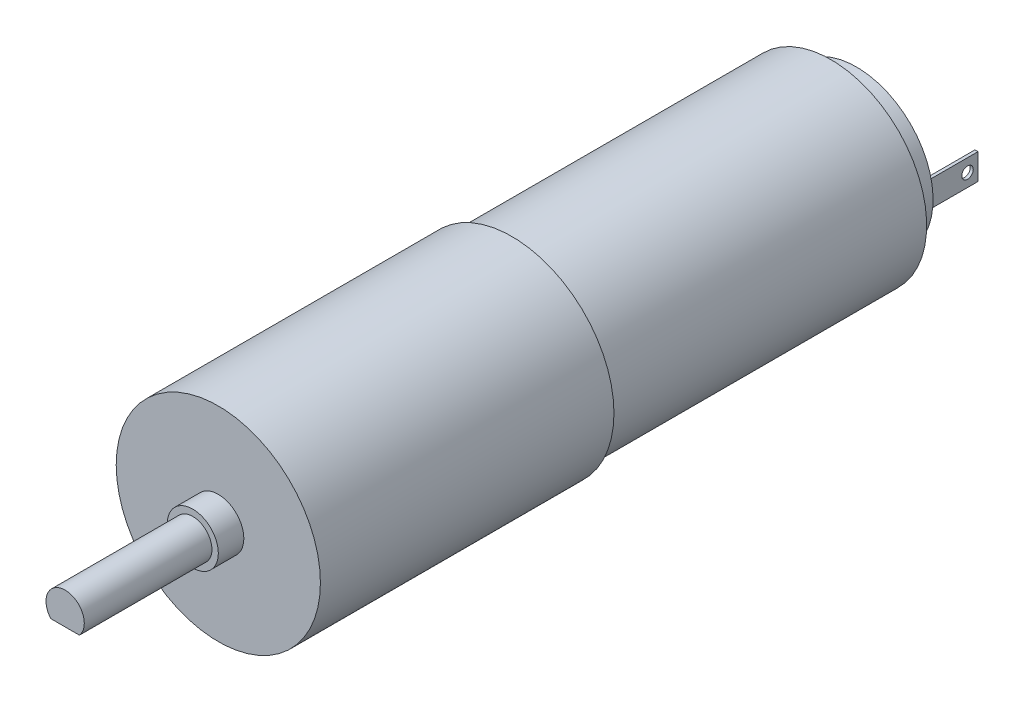
from build123d import *

# Parameters (mm, degrees)
SKETCH_1_R          = 8
EXTRUDE_1_DEPTH     = 23
SKETCH_2_R          = 6
EXTRUDE_2_DEPTH     = 27
SKETCH_3_R          = 1.5
EXTRUDE_3_DEPTH     = 12
SKETCH_4_R          = 2
EXTRUDE_4_DEPTH     = 2
SKETCH_5_R          = 7.5
EXTRUDE_6_DEPTH     = 25
CUT_EXTRUDE_2_DEPTH = 25
SKETCH_7_W          = 0.238746812
SKETCH_7_H          = 2.029347906
SKETCH_7_W_2        = 0.208903461
EXTRUDE_7_DEPTH     = 4
SKETCH_8_R          = 0.451828616
CUT_EXTRUDE_3_DEPTH = 40
SKETCH_9_W          = 4.595876138
SKETCH_9_H          = 0.537180328
CUT_EXTRUDE_4_DEPTH = 6


with BuildPart() as part:
    # 草图1 → 凸台-拉伸1 (new body)
    with BuildSketch(Plane.XY):
        Circle(SKETCH_1_R)
    extrude(amount=EXTRUDE_1_DEPTH)

    # 草图2 → 凸台-拉伸2 (add)
    with BuildSketch(Plane(origin=(0, 0, 0), x_dir=(-1, 0, 0), z_dir=(0, 0, -1))):
        Circle(SKETCH_2_R)
    extrude(amount=EXTRUDE_2_DEPTH)

    # 草图3 → 凸台-拉伸3 (add)
    with BuildSketch(Plane.XY.offset(23)):
        Circle(SKETCH_3_R)
    extrude(amount=EXTRUDE_3_DEPTH)

    # 草图4 → 凸台-拉伸4 (add)
    with BuildSketch(Plane.XY.offset(23)):
        Circle(SKETCH_4_R)
    extrude(amount=EXTRUDE_4_DEPTH)

    # 草图5 → 凸台-拉伸6 (add)
    with BuildSketch(Plane(origin=(0, 0, 0), x_dir=(-1, 0, 0), z_dir=(0, 0, -1))):
        with Locations(Location((0, 0, 0), (0, 0, 180))):
            Circle(SKETCH_5_R)
    extrude(amount=EXTRUDE_6_DEPTH)

    # 草图6 → 切除-拉伸2 (cut)
    with BuildSketch(Plane(origin=(0, 0, -25), x_dir=(-1, 0, 0), z_dir=(0, 0, -1))):
        Polygon((0, -6), (7.251934426, -6), (7.251934426, -9), (-7.072874317, -9), (-7.072874317, -6), align=None)
    extrude(amount=-CUT_EXTRUDE_2_DEPTH, mode=Mode.SUBTRACT)

    # 草图7 → 凸台-拉伸7 (add)
    with BuildSketch(Plane(origin=(0, 0, -27), x_dir=(-1, 0, 0), z_dir=(0, 0, -1))):
        with Locations((-5.40164663, 0)):
            Rectangle(SKETCH_7_W, SKETCH_7_H)
        with Locations((5.371803278, 0)):
            Rectangle(SKETCH_7_W_2, SKETCH_7_H)
    extrude(amount=EXTRUDE_7_DEPTH)

    # 草图8 → 切除-拉伸3 (cut)
    with BuildSketch(Plane(origin=(5.521020036, 0, 0), x_dir=(0, 0, -1), z_dir=(1, 0, 0))):
        with Locations((30.17785099, 0)):
            Circle(SKETCH_8_R)
    extrude(amount=-CUT_EXTRUDE_3_DEPTH, mode=Mode.SUBTRACT)

    # 草图9 → 切除-拉伸4 (cut)
    with BuildSketch(Plane.XY.offset(35)):
        with Locations((0, -1.268342441)):
            Rectangle(SKETCH_9_W, SKETCH_9_H)
    extrude(amount=-CUT_EXTRUDE_4_DEPTH, mode=Mode.SUBTRACT)


solid = part.part
